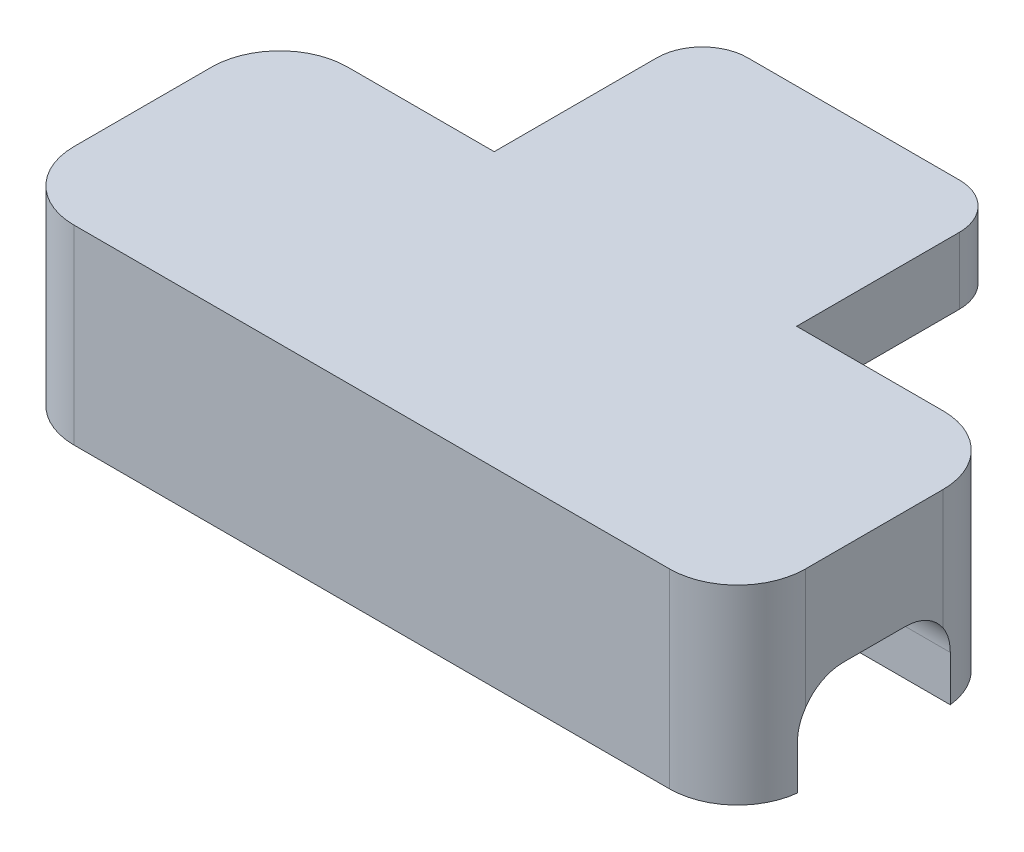
from build123d import *

# Parameters (mm, degrees)
BOSS_EXTRUDE1_DEPTH             = 4.44
BOSS_EXTRUDE1_DEPTH_BACK        = 6
SKETCH21_W                      = 15.69
SKETCH21_H                      = 24
BOSS_EXTRUDE1_2_DEPTH           = 4.44
BOSS_EXTRUDE1_2_DEPTH_BACK      = 6
CUT_EXTRUDE4_DEPTH              = 36.336045336
CUT_EXTRUDE4_DEPTH_BACK         = 36.336045336
SKETCH20_W                      = 31.709739698
SKETCH20_H                      = 13.674781638
BOSS_EXTRUDE4_DEPTH             = 1.5
BOSS_EXTRUDE5_DEPTH             = 4.51
BOSS_EXTRUDE2_REACH             = 42.56
BOSS_EXTRUDE2_DIRECTION_2_REACH = 42.56
BOSS_EXTRUDE3_DEPTH             = 18.1
FILLET1_R                       = 3
FILLET2_R                       = 3
CUT_EXTRUDE5_DEPTH              = 18.5
CUT_EXTRUDE5_DEPTH_BACK         = 1
SKETCH30_W                      = 14.19
SKETCH30_H                      = 18.1
BOSS_EXTRUDE6_DEPTH             = 6.01
BOSS_EXTRUDE7_REACH             = 42.039
SKETCH31_W                      = 19.5
SKETCH31_H                      = 2
BOSS_EXTRUDE7_DIRECTION_2_REACH = 42.039
CUT_EXTRUDE6_REACH              = 48.573
FILLET3_R                       = 4.5
SKETCH35_W                      = 12
SKETCH35_H                      = 5
CUT_EXTRUDE7_DEPTH              = 0.7


with BuildPart() as part:
    # Sketch21 → Boss-Extrude1 (new, two sides: drawn at the far end of the back side and taken through both)
    with BuildSketch(Plane(origin=(0, 0, 0), x_dir=(1, 0, 0), z_dir=(0, 1, 0)).offset(-BOSS_EXTRUDE1_DEPTH_BACK)):
        with Locations((-7.845, 0)):
            Rectangle(SKETCH21_W, SKETCH21_H)
    extrude(amount=BOSS_EXTRUDE1_DEPTH + BOSS_EXTRUDE1_DEPTH_BACK)


with BuildPart() as body_2:
    # Sketch21 → Boss-Extrude1 2 (new, two sides: drawn at the far end of the back side and taken through both)
    with BuildSketch(Plane(origin=(0, 0, 0), x_dir=(1, 0, 0), z_dir=(0, 1, 0)).offset(-BOSS_EXTRUDE1_2_DEPTH_BACK)):
        with Locations((24.845, 0)):
            Rectangle(SKETCH21_W, SKETCH21_H)
    extrude(amount=BOSS_EXTRUDE1_2_DEPTH + BOSS_EXTRUDE1_2_DEPTH_BACK)


with BuildPart() as cut_extrude4_tool:
    # Sketch20 → Cut-Extrude4 (new, two sides: drawn at the far end of the back side and taken through both)
    with BuildSketch(Plane(origin=(0, 0, 0), x_dir=(0, 0, -1), z_dir=(1, 0, 0)).offset(-CUT_EXTRUDE4_DEPTH_BACK)):
        with Locations((-0.27698472, -0.290016026)):
            Rectangle(SKETCH20_W, SKETCH20_H)
        Polygon((-5.7, -0.36), (-5.7, -3.36), (-9.7, -3.36), (-9.7, 4.14), (8.4, 4.14), (8.4, -3.36), (4.4, -3.36), (4.4, -0.36), (4.4, 2.64), (1.4, 2.64), (0, 2.64), (-2.7, 2.64), (-5.7, 2.64), align=None, mode=Mode.SUBTRACT)
    extrude(amount=CUT_EXTRUDE4_DEPTH + CUT_EXTRUDE4_DEPTH_BACK)


with BuildPart() as part_1:
    add(part.part)

    # Cut-Extrude4: cut by cut_extrude4_tool
    add(cut_extrude4_tool.part, mode=Mode.SUBTRACT)



with BuildPart() as body_2_1:
    add(body_2.part)

    # Cut-Extrude4: cut by cut_extrude4_tool
    add(cut_extrude4_tool.part, mode=Mode.SUBTRACT)


with BuildPart() as body_3:
    # Sketch28 → Boss-Extrude4 (new body)
    with BuildSketch(Plane(origin=(0, 7.74, 0), x_dir=(1, 0, 0), z_dir=(0, 1, 0))):
        with BuildLine():
            Line((-1.5, 19.16), (-1.5, -1.34))
            Line((-1.5, -1.34), (-1.5, -9.7))
            Line((-1.5, -9.7), (18.5, -9.7))
            Line((18.5, -9.7), (18.5, -1.34))
            Line((18.5, -1.34), (18.5, 19.16))
            ThreePointArc((18.5, 19.16), (17.621320344, 21.281320344), (15.5, 22.16))
            Line((15.5, 22.16), (1.5, 22.16))
            ThreePointArc((1.5, 22.16), (-0.621320344, 21.281320344), (-1.5, 19.16))
        make_face()
    extrude(amount=BOSS_EXTRUDE4_DEPTH)


with BuildPart() as part_2:
    add(part_1.part)

    add(body_2_1.part)  # Boss-Extrude5 merges body 2

    add(body_3.part)  # Boss-Extrude5 merges body 3
    # Sketch26 → Boss-Extrude5 (add)
    with BuildSketch(Plane(origin=(0, 7.74, 0), x_dir=(1, 0, 0), z_dir=(0, 1, 0))):
        with BuildLine():
            Line((-1.5, 19.16), (-1.5, -0.04))
            Line((-1.5, -0.04), (-1.5, -9.7))
            Line((-1.5, -9.7), (18.5, -9.7))
            Line((18.5, -9.7), (18.5, -1.9))
            Line((18.5, -1.9), (18.5, 19.16))
            ThreePointArc((18.5, 19.16), (17.621320344, 21.281320344), (15.5, 22.16))
            Line((15.5, 22.16), (1.5, 22.16))
            ThreePointArc((1.5, 22.16), (-0.621320344, 21.281320344), (-1.5, 19.16))
        make_face()
        with BuildLine():
            Line((2.75, 21.16), (14.25, 21.16))
            ThreePointArc((14.25, 21.16), (16.371320344, 20.281320344), (17.25, 18.16))
            Line((17.25, 18.16), (17.25, -0.4))
            ThreePointArc((17.25, -0.4), (16.371320344, -2.521320344), (14.25, -3.4))
            Line((14.25, -3.4), (2.75, -3.4))
            ThreePointArc((2.75, -3.4), (0.628679656, -2.521320344), (-0.25, -0.4))
            Line((-0.25, -0.4), (-0.25, 18.16))
            ThreePointArc((-0.25, 18.16), (0.628679656, 20.281320344), (2.75, 21.16))
        make_face(mode=Mode.SUBTRACT)
    extrude(amount=-BOSS_EXTRUDE5_DEPTH)

    # Boss-Extrude2: up to this face of the body (flat: up to its plane)
    boss_extrude2_end = Plane(part_2.part.faces().sort_by_distance((-7.845, -3.36, -6.4))[0])
    # Sketch24 → Boss-Extrude2 (add, up to the picked face)
    with BuildSketch(Plane(origin=(0, 0, 0), x_dir=(1, 0, 0), z_dir=(0, 1, 0)), mode=Mode.PRIVATE) as boss_extrude2_sk1:
        Polygon((-11.19, 8.4), (-15.69, 8.4), (-15.69, -9.7), (-11.19, -9.7), (-8.19, -9.7), (-8.19, -5.7), (-11.19, -5.7), (-11.19, 4.4), (-8.19, 4.4), (-8.19, 8.4), align=None)
    boss_extrude2_tool1 = split(extrude(boss_extrude2_sk1.sketch, amount=-BOSS_EXTRUDE2_REACH, mode=Mode.PRIVATE), bisect_by=boss_extrude2_end, keep=Keep.BOTH, mode=Mode.PRIVATE)
    add(boss_extrude2_tool1.solids().sort_by(Axis((-12.586515, 0, 0.65), (0, -1, 0)))[0])

    # Boss-Extrude2 direction 2: up to this face of the body (flat: up to its plane)
    boss_extrude2_direction_2_end = Plane(part_2.part.faces().sort_by_distance((-0.122932559, 4.14, -3.592771757))[0])
    # Sketch24 → Boss-Extrude2 direction 2 (add, up to the picked face)
    with BuildSketch(Plane(origin=(0, 0, 0), x_dir=(1, 0, 0), z_dir=(0, 1, 0)), mode=Mode.PRIVATE) as boss_extrude2_direction_2_sk1:
        Polygon((-11.19, 8.4), (-15.69, 8.4), (-15.69, -9.7), (-11.19, -9.7), (-8.19, -9.7), (-8.19, -5.7), (-11.19, -5.7), (-11.19, 4.4), (-8.19, 4.4), (-8.19, 8.4), align=None)
    boss_extrude2_direction_2_tool1 = split(extrude(boss_extrude2_direction_2_sk1.sketch, amount=BOSS_EXTRUDE2_DIRECTION_2_REACH, mode=Mode.PRIVATE), bisect_by=boss_extrude2_direction_2_end, keep=Keep.BOTH, mode=Mode.PRIVATE)
    add(boss_extrude2_direction_2_tool1.solids().sort_by(Axis((-12.586515, 0, 0.65), (0, 1, 0)))[0])

    # Sketch25 → Boss-Extrude3 (add)
    with BuildSketch(Plane.XY.offset(9.7)):
        Polygon((-15.69, -3.36), (-11.19, -3.36), (-11.19, 0.242208851), (-11.19, 3.242208851), (-8.19, 3.242208851), (-8.19, 4.14), (-11.19, 4.14), (-15.69, 4.14), align=None)
    extrude(amount=-BOSS_EXTRUDE3_DEPTH)

    # Fillet1
    fillet1_edges = [part_2.edges().sort_by_distance(p)[0] for p in [
        (-5.595, 2.64, 5.7),
        (-5.595, 2.64, -4.4),
        (-11.19, 2.64, 0.65),
        (-11.19, -0.36, -4.4),
        (-11.19, -0.36, 5.7),
    ]]
    fillet(fillet1_edges, radius=FILLET1_R)

    # Fillet2
    fillet2_edges = [part_2.edges().sort_by_distance(p)[0] for p in [
        (24.845, 2.64, -4.4),
        (24.845, 2.64, 5.7),
    ]]
    fillet(fillet2_edges, radius=FILLET2_R)

    # Sketch29 → Cut-Extrude5 (cut, two sides: drawn at the far end of the back side and taken through both)
    with BuildSketch(Plane(origin=(-0.25, 0, 0), x_dir=(0, 0, -1), z_dir=(1, 0, 0)).offset(-CUT_EXTRUDE5_DEPTH_BACK)):
        with BuildLine():
            Line((-5.7, -0.36), (-5.7, -3.36))
            Line((-5.7, -3.36), (-9.7, -3.36))
            Line((-9.7, -3.36), (-9.7, 4.14))
            Line((-9.7, 4.14), (8.4, 4.14))
            Line((8.4, 4.14), (8.4, -3.36))
            Line((8.4, -3.36), (4.4, -3.36))
            Line((4.4, -3.36), (4.4, -0.36))
            ThreePointArc((4.4, -0.36), (3.521320344, 1.761320344), (1.4, 2.64))
            Line((1.4, 2.64), (0, 2.64))
            Line((0, 2.64), (-2.7, 2.64))
            ThreePointArc((-2.7, 2.64), (-4.821320344, 1.761320344), (-5.7, -0.36))
        make_face()
    extrude(amount=CUT_EXTRUDE5_DEPTH + CUT_EXTRUDE5_DEPTH_BACK, mode=Mode.SUBTRACT)

    # Sketch30 → Boss-Extrude6 (add)
    with BuildSketch(Plane(origin=(0, 3.23, 0), x_dir=(1, 0, 0), z_dir=(0, 1, 0))):
        with Locations((-8.595, -0.65)):
            Rectangle(SKETCH30_W, SKETCH30_H)
        with Locations((25.595, -0.65)):
            Rectangle(SKETCH30_W, SKETCH30_H)
    extrude(amount=BOSS_EXTRUDE6_DEPTH)

    # Boss-Extrude7: up to this face of the body (flat: up to its plane)
    boss_extrude7_end = Plane(part_2.part.faces().sort_by_distance((25.47, -3.36, 7.7))[0])
    # Sketch31 → Boss-Extrude7 (add, up to the picked face)
    with BuildSketch(Plane(origin=(0, 3.23, 0), x_dir=(1, 0, 0), z_dir=(0, 1, 0)), mode=Mode.PRIVATE) as boss_extrude7_sk1:
        with Locations((8.5, -8.7)):
            Rectangle(SKETCH31_W, SKETCH31_H)
    boss_extrude7_tool1 = split(extrude(boss_extrude7_sk1.sketch, amount=-BOSS_EXTRUDE7_REACH, mode=Mode.PRIVATE), bisect_by=boss_extrude7_end, keep=Keep.BOTH, mode=Mode.PRIVATE)
    add(boss_extrude7_tool1.solids().sort_by(Axis((8.5, 3.23, 8.7), (0, -1, 0)))[0])

    # Sketch31 → Boss-Extrude7 direction 2 (add, up to next)
    with BuildSketch(Plane(origin=(0, 3.23, 0), x_dir=(1, 0, 0), z_dir=(0, 1, 0)), mode=Mode.PRIVATE) as boss_extrude7_direction_2_sk1:
        with Locations((8.5, -8.7)):
            Rectangle(SKETCH31_W, SKETCH31_H)
    boss_extrude7_direction_2_tool1 = extrude(boss_extrude7_direction_2_sk1.sketch, amount=BOSS_EXTRUDE7_DIRECTION_2_REACH, mode=Mode.PRIVATE) - part_2.part
    add(boss_extrude7_direction_2_tool1.solids().sort_by_distance((8.5, 3.23, 8.7))[0])

    # Cut-Extrude6: up to this face of the body (flat: up to its plane)
    cut_extrude6_end = Plane(part_2.part.faces().sort_by_distance((25.529078635, 2.912563199, -8.4))[0])
    # Sketch33 → Cut-Extrude6 (cut, up to the picked face)
    with BuildSketch(Plane(origin=(0, 0, -22.16), x_dir=(-1, 0, 0), z_dir=(0, 0, -1)), mode=Mode.PRIVATE) as cut_extrude6_sk1:
        with BuildLine():
            Line((15.69, 4.83), (15.69, -3.36))
            Line((15.69, -3.36), (-32.69, -3.36))
            Line((-32.69, -3.36), (-32.69, 4.83))
            Line((-32.69, 4.83), (-13.1, 4.83))
            Line((-13.1, 4.83), (-13.1, 4.94))
            ThreePointArc((-13.1, 4.94), (-12.719238816, 5.859238816), (-11.8, 6.24))
            Line((-11.8, 6.24), (-5.2, 6.24))
            ThreePointArc((-5.2, 6.24), (-4.280761184, 5.859238816), (-3.9, 4.94))
            Line((-3.9, 4.94), (-3.9, 4.83))
            Line((-3.9, 4.83), (15.69, 4.83))
        make_face()
    cut_extrude6_tool1 = split(extrude(cut_extrude6_sk1.sketch, amount=-CUT_EXTRUDE6_REACH, mode=Mode.PRIVATE), bisect_by=cut_extrude6_end, keep=Keep.BOTH, mode=Mode.PRIVATE)
    add(cut_extrude6_tool1.solids().sort_by(Axis((8.5, 0.878173, -22.16), (0, 0, 1)))[0], mode=Mode.SUBTRACT)

    # Fillet3
    fillet3_edges = [part_2.edges().sort_by_distance(p)[0] for p in [
        (32.69, 2.94, -8.4),
        (32.69, 2.94, 9.7),
        (-15.69, 2.94, -8.4),
        (-15.69, 2.94, 9.7),
    ]]
    fillet(fillet3_edges, radius=FILLET3_R)

    # Sketch35 → Cut-Extrude7 (cut)
    with BuildSketch(Plane.XZ.offset(-7.74)):
        with Locations((8.5, 0.9)):
            Rectangle(SKETCH35_W, SKETCH35_H)
    extrude(amount=-CUT_EXTRUDE7_DEPTH, mode=Mode.SUBTRACT)


solid = part_2.part
